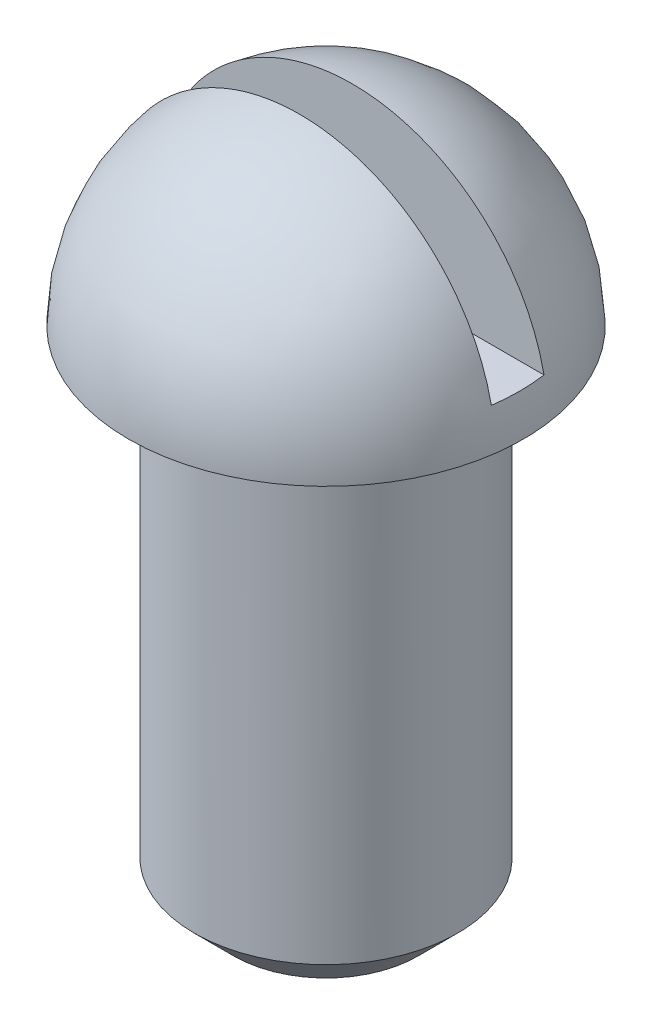
from build123d import *

# Parameters (mm, degrees)
CUT_EXTRUDE1_DEPTH      = 44.520110294
CUT_EXTRUDE1_DEPTH_BACK = 44.520110294
SKETCH3_W               = 4
SKETCH3_H               = 15
CHAMFER1_SIZE           = 3


with BuildPart() as part:
    # Sketch1 → Revolve1 (revolve)
    with BuildSketch(Plane(origin=(0, 0, 0), x_dir=(0, 0, -1), z_dir=(1, 0, 0))):
        with BuildLine():
            Line((0, -38), (0, 15))
            ThreePointArc((0, 15), (10.606601718, 10.606601718), (15, 0))
            Line((15, 0), (10, 0))
            Line((10, 0), (10, -38))
            Line((10, -38), (0, -38))
        make_face()
    revolve(axis=Axis((0, -38, 0), (0, 1, 0)))

    # Sketch3 → Cut-Extrude1 (cut, two sides: drawn at the far end of the back side and taken through both)
    with BuildSketch(Plane(origin=(0, 0, 0), x_dir=(0, 0, -1), z_dir=(1, 0, 0)).offset(-CUT_EXTRUDE1_DEPTH_BACK)):
        with Locations((0, 10.5)):
            Rectangle(SKETCH3_W, SKETCH3_H)
    extrude(amount=CUT_EXTRUDE1_DEPTH + CUT_EXTRUDE1_DEPTH_BACK, mode=Mode.SUBTRACT)

    # Chamfer1
    chamfer1_edges = [part.edges().sort_by_distance(p)[0] for p in [
        (0, -38, 10),
    ]]
    chamfer(chamfer1_edges, length=CHAMFER1_SIZE)


solid = part.part
